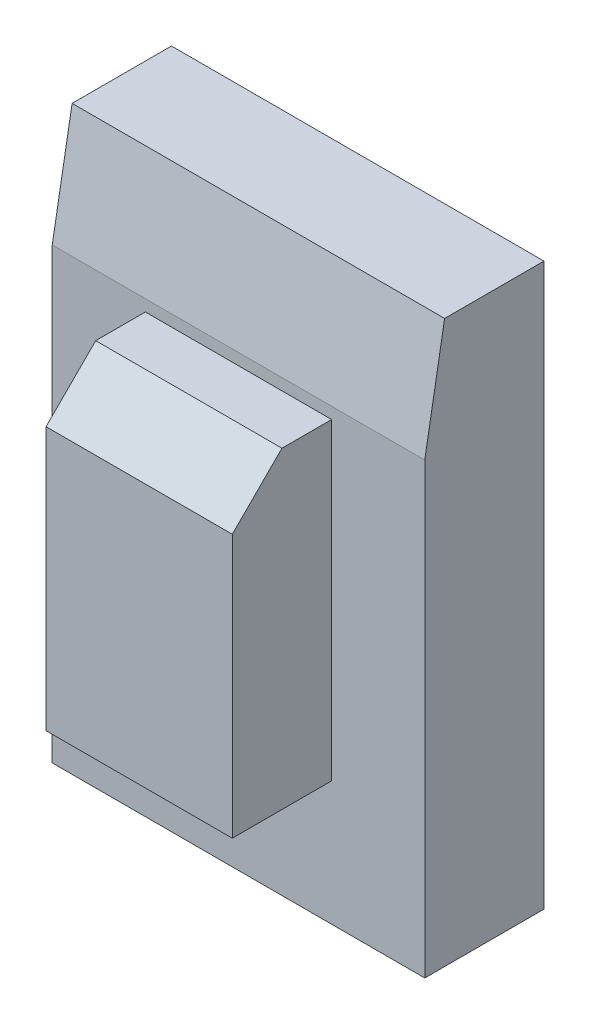
from build123d import *

# Parameters (mm, degrees)
SKETCH1_W           = 9.525
SKETCH1_H           = 14.351
BOSS_EXTRUDE1_DEPTH = 3.048
SKETCH2_W           = 4.7625
SKETCH2_H           = 8.001
BOSS_EXTRUDE2_DEPTH = 2.54
CHAMFER1_SIZE       = 1.27
CHAMFER2_SIZE       = 0.508
CHAMFER2_SIZE2      = 2.881011164


with BuildPart() as part:
    # Sketch1 → Boss-Extrude1 (new body)
    with BuildSketch(Plane.XY):
        with Locations((4.7625, -7.1755)):
            Rectangle(SKETCH1_W, SKETCH1_H)
    extrude(amount=BOSS_EXTRUDE1_DEPTH)

    # Sketch2 → Boss-Extrude2 (add)
    with BuildSketch(Plane.XY.offset(3.048)):
        with Locations((4.7625, -7.1755)):
            Rectangle(SKETCH2_W, SKETCH2_H)
    extrude(amount=BOSS_EXTRUDE2_DEPTH)

    # Chamfer1
    chamfer1_edges = [part.edges().sort_by_distance(p)[0] for p in [
        (4.7625, -3.175, 5.588),
    ]]
    chamfer(chamfer1_edges, length=CHAMFER1_SIZE)

    # Chamfer2
    chamfer2_edges = [part.edges().sort_by_distance(p)[0] for p in [
        (4.7625, 0, 3.048),
    ]]
    chamfer2_side = [part.faces().sort_by_distance(p)[0] for p in [
        (4.7625, 0, 1.524),
    ]]
    chamfer(chamfer2_edges, length=CHAMFER2_SIZE, length2=CHAMFER2_SIZE2, reference=chamfer2_side[0])


solid = part.part
